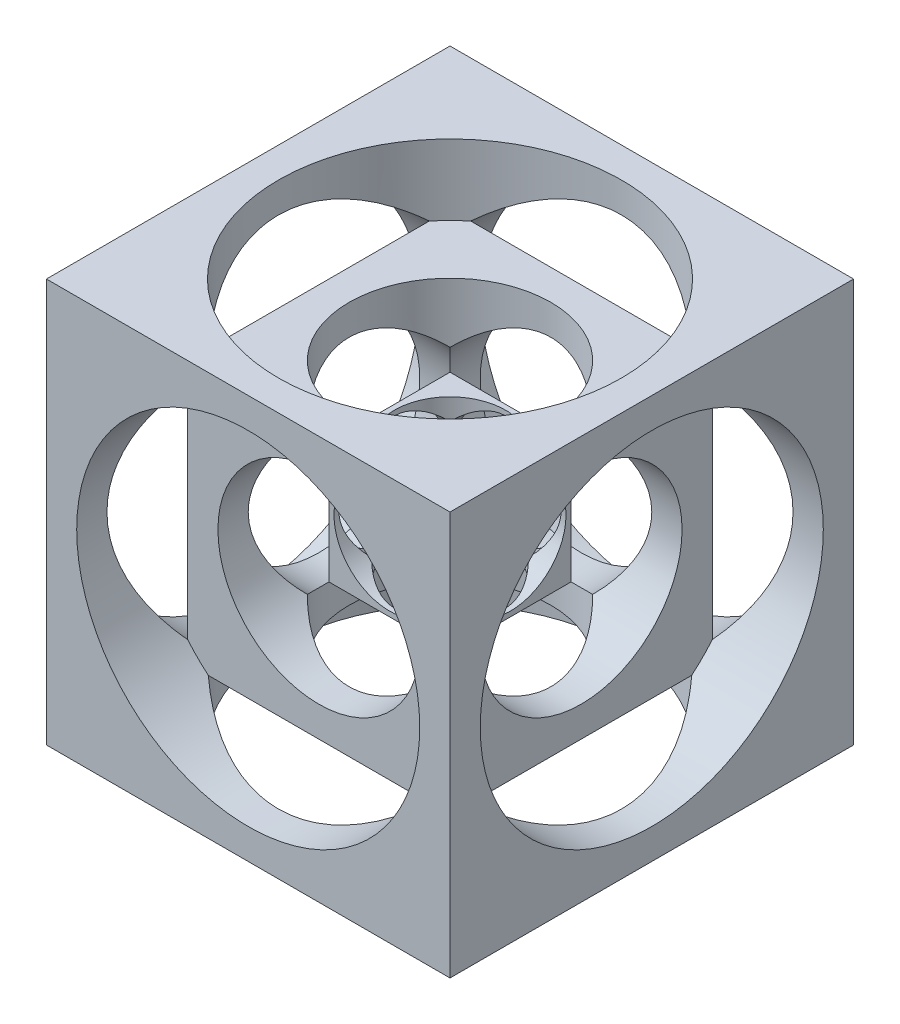
from build123d import *

# Parameters (mm, degrees)
BOSS_EXTRUDE1_DEPTH      = 25.4
BOSS_EXTRUDE1_DEPTH_BACK = 25.4
SKETCH3_W                = 50.8
SKETCH3_H                = 50.8
SKETCH4_R                = 21.59
CUT_EXTRUDE1_DEPTH       = 8.89
SKETCH5_R                = 12.7
CUT_EXTRUDE2_DEPTH       = 17.78
SKETCH6_R                = 6.985
CUT_EXTRUDE3_DEPTH       = 25.4
CIRPATTERN1_COUNT        = 4
CIRPATTERN6_COUNT        = 4


with BuildPart() as part:
    # Sketch3 → Boss-Extrude1 (new, two sides: drawn at the far end of the back side and taken through both)
    with BuildSketch(Plane.XY.offset(-BOSS_EXTRUDE1_DEPTH_BACK)):
        Rectangle(SKETCH3_W, SKETCH3_H)
    extrude(amount=BOSS_EXTRUDE1_DEPTH + BOSS_EXTRUDE1_DEPTH_BACK)

    # Sketch4 → Cut-Extrude1 (cut)
    with BuildSketch(Plane.XY.offset(25.4)):
        Circle(SKETCH4_R)
    cut_extrude1 = extrude(amount=-CUT_EXTRUDE1_DEPTH, mode=Mode.SUBTRACT)

    # Sketch5 → Cut-Extrude2 (cut)
    with BuildSketch(Plane.XY.offset(25.4)):
        Circle(SKETCH5_R)
    cut_extrude2 = extrude(amount=-CUT_EXTRUDE2_DEPTH, mode=Mode.SUBTRACT)

    # Sketch6 → Cut-Extrude3 (cut)
    with BuildSketch(Plane.XY.offset(25.4)):
        Circle(SKETCH6_R)
    cut_extrude3 = extrude(amount=-CUT_EXTRUDE3_DEPTH, mode=Mode.SUBTRACT)

    # CirPattern1: Cut-Extrude1, Cut-Extrude2, Cut-Extrude3 ×4 about axis
    cirpattern1_axis = Axis((0, 0, 0), (0, 1, 0))
    add([cut_extrude1.rotate(cirpattern1_axis, i * 360 / CIRPATTERN1_COUNT) for i in range(1, CIRPATTERN1_COUNT)], mode=Mode.SUBTRACT)
    add([cut_extrude2.rotate(cirpattern1_axis, i * 360 / CIRPATTERN1_COUNT) for i in range(1, CIRPATTERN1_COUNT)], mode=Mode.SUBTRACT)
    add([cut_extrude3.rotate(cirpattern1_axis, i * 360 / CIRPATTERN1_COUNT) for i in range(1, CIRPATTERN1_COUNT)], mode=Mode.SUBTRACT)

    # CirPattern6: Cut-Extrude1, Cut-Extrude2, Cut-Extrude3 ×4 about axis
    cirpattern6_axis = Axis((0, 0, 0), (1, 0, 0))
    add([cut_extrude1.rotate(cirpattern6_axis, i * 360 / CIRPATTERN6_COUNT) for i in range(1, CIRPATTERN6_COUNT)], mode=Mode.SUBTRACT)
    add([cut_extrude2.rotate(cirpattern6_axis, i * 360 / CIRPATTERN6_COUNT) for i in range(1, CIRPATTERN6_COUNT)], mode=Mode.SUBTRACT)
    add([cut_extrude3.rotate(cirpattern6_axis, i * 360 / CIRPATTERN6_COUNT) for i in range(1, CIRPATTERN6_COUNT)], mode=Mode.SUBTRACT)


solid = part.part
